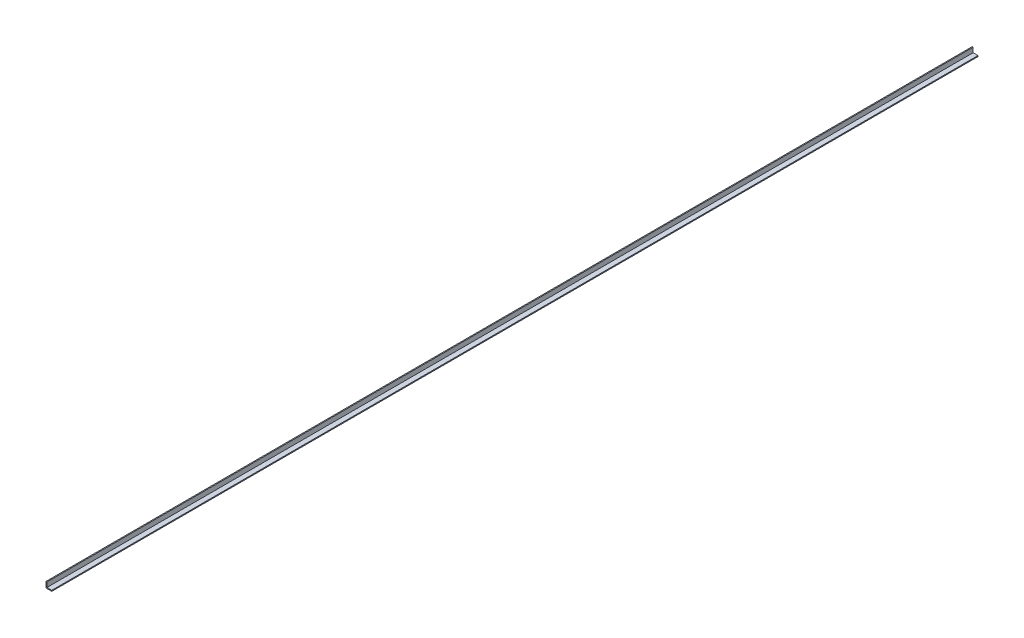
from build123d import *

# Parameters (mm, degrees)
SALIENTE_EXTRUIR1_DEPTH = 6100


with BuildPart() as part:
    # Croquis1 → Saliente-Extruir1 (new body)
    with BuildSketch(Plane.XY):
        Polygon((0, 38.1), (0, 0), (38.1, 0), (38.1, 6.35), (6.35, 6.35), (6.35, 38.1), align=None)
    extrude(amount=-SALIENTE_EXTRUIR1_DEPTH)


solid = part.part
